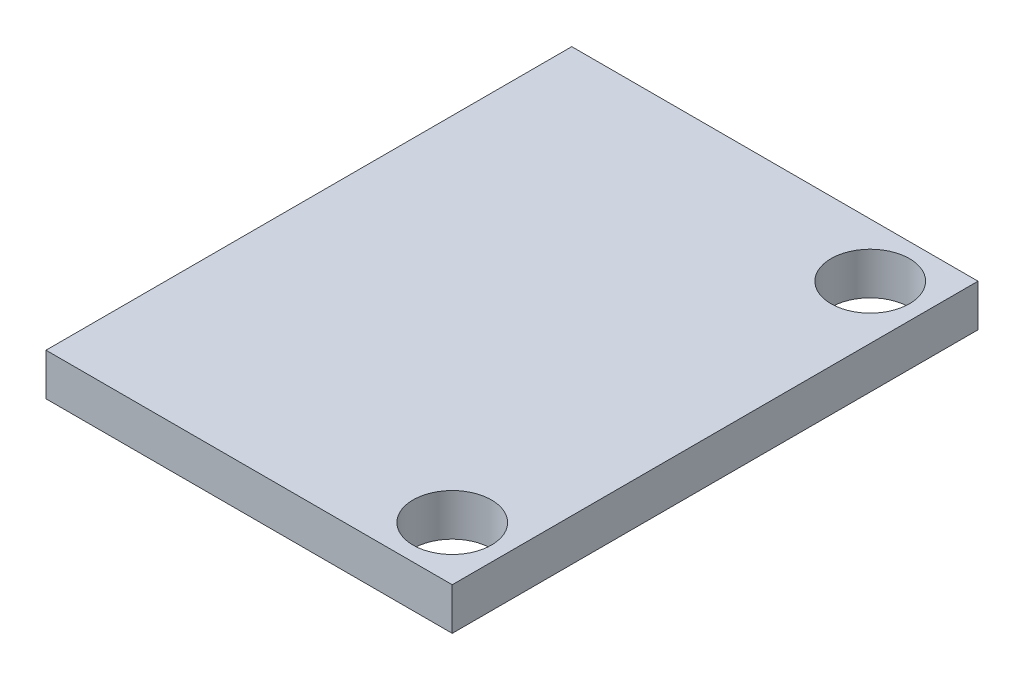
from build123d import *

# Parameters (mm, degrees)
SKETCH1_W           = 15.7988
SKETCH1_H           = 20.447
BOSS_EXTRUDE1_DEPTH = 1.6383
SKETCH2_R           = 1.524
CUT_EXTRUDE1_DEPTH  = 1.6383


with BuildPart() as part:
    # Sketch1 → Boss-Extrude1 (new body)
    with BuildSketch(Plane(origin=(0, 0, 0), x_dir=(1, 0, 0), z_dir=(0, 1, 0))):
        Rectangle(SKETCH1_W, SKETCH1_H)
    extrude(amount=BOSS_EXTRUDE1_DEPTH)

    # Sketch2 → Cut-Extrude1 (cut)
    with BuildSketch(Plane(origin=(0, 1.6383, 0), x_dir=(1, 0, 0), z_dir=(0, 1, 0))):
        with Locations(Location((5.8039, -8.128, 0), (0, 0, 270))):
            Circle(SKETCH2_R)
        with Locations(Location((5.8039, 8.128, 0), (0, 0, 270))):
            Circle(SKETCH2_R)
    extrude(amount=-CUT_EXTRUDE1_DEPTH, mode=Mode.SUBTRACT)


solid = part.part
